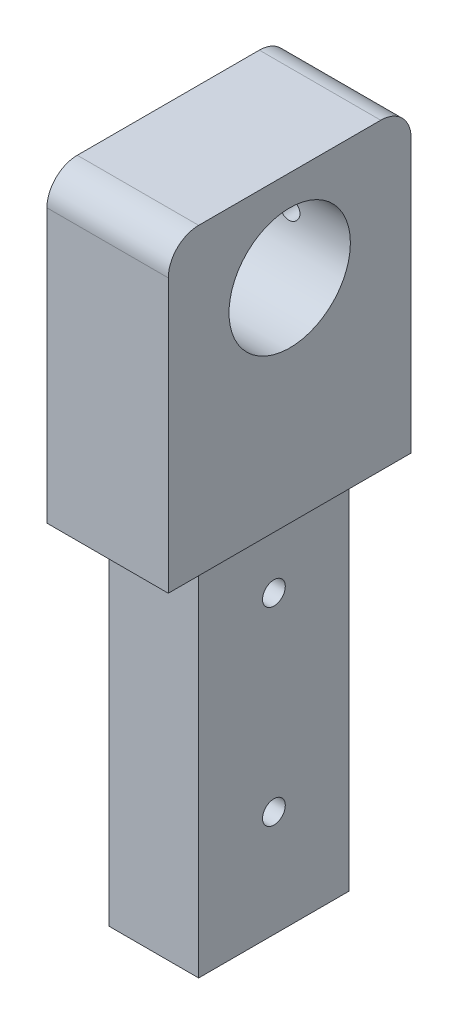
from build123d import *

# Parameters (mm, degrees)
SKETCH2_W               = 20.828
SKETCH2_H               = 33.528
BOSS_EXTRUDE1_DEPTH     = 76.2
SKETCH3_W               = 25.4
SKETCH3_H               = 50.8
BOSS_EXTRUDE2_DEPTH     = 63.5
FILLET1_R               = 6.35
SKETCH4_R               = 12.7
CUT_EXTRUDE1_DEPTH      = 145.244271983
CUT_EXTRUDE2_REACH      = 151.191
CUT_EXTRUDE2_END_RADIUS = 12.7
SKETCH5_R               = 2.15265
SKETCH6_W               = 20.828
SKETCH6_H               = 33.528
CUT_EXTRUDE3_DEPTH      = 76.2
SKETCH7_R               = 2.38125
CUT_EXTRUDE4_DEPTH      = 78.74


with BuildPart() as part:
    # Sketch2 → Boss-Extrude1 (new body)
    with BuildSketch(Plane(origin=(0, 0, 0), x_dir=(1, 0, 0), z_dir=(0, 1, 0))):
        Rectangle(SKETCH2_W, SKETCH2_H)
    extrude(amount=BOSS_EXTRUDE1_DEPTH)

    # Sketch3 → Boss-Extrude2 (add)
    with BuildSketch(Plane(origin=(0, 76.2, 0), x_dir=(1, 0, 0), z_dir=(0, 1, 0))):
        Rectangle(SKETCH3_W, SKETCH3_H)
    extrude(amount=BOSS_EXTRUDE2_DEPTH)

    # Fillet1
    fillet1_edges = [part.edges().sort_by_distance(p)[0] for p in [
        (0, 139.7, -25.4),
        (0, 139.7, 25.4),
    ]]
    fillet(fillet1_edges, radius=FILLET1_R)

    # Sketch4 → Cut-Extrude1 (cut, through all)
    with BuildSketch(Plane(origin=(12.7, 0, 0), x_dir=(0, 0, -1), z_dir=(1, 0, 0))):
        with Locations((0, 120.65)):
            Circle(SKETCH4_R)
    extrude(amount=-CUT_EXTRUDE1_DEPTH, mode=Mode.SUBTRACT)

    # Cut-Extrude2: up to this cylinder (the profile starts outside it)
    cut_extrude2_end = Plane(origin=(0, 120.65, 0), z_dir=(1, 0, 0)) * Cylinder(CUT_EXTRUDE2_END_RADIUS, 328.782, mode=Mode.PRIVATE)
    # Sketch5 → Cut-Extrude2 (cut, up to the surface)
    with BuildSketch(Plane(origin=(0, 0, -25.4), x_dir=(-1, 0, 0), z_dir=(0, 0, -1)), mode=Mode.PRIVATE) as cut_extrude2_sk1:
        with Locations((0, 120.65)):
            Circle(SKETCH5_R)
    cut_extrude2_tool1 = extrude(cut_extrude2_sk1.sketch, amount=-CUT_EXTRUDE2_REACH, mode=Mode.PRIVATE) - cut_extrude2_end
    add(cut_extrude2_tool1.solids().sort_by_distance((0, 120.65, -25.4))[0], mode=Mode.SUBTRACT)

    # Sketch6 → Cut-Extrude3 (cut)
    with BuildSketch(Plane.XZ):
        Rectangle(SKETCH6_W, SKETCH6_H)
        Polygon((-9.398, -15.748), (-9.398, 15.748), (0, 15.748), (9.398, 15.748), (9.398, -15.748), align=None, mode=Mode.SUBTRACT)
    extrude(amount=-CUT_EXTRUDE3_DEPTH, mode=Mode.SUBTRACT)

    # Sketch7 → Cut-Extrude4 (cut)
    with BuildSketch(Plane(origin=(9.398, 0, 0), x_dir=(0, 0, -1), z_dir=(1, 0, 0))):
        with Locations((0, 61.9125)):
            Circle(SKETCH7_R)
        with Locations((0, 22.225)):
            Circle(SKETCH7_R)
    extrude(amount=-CUT_EXTRUDE4_DEPTH, mode=Mode.SUBTRACT)


solid = part.part
